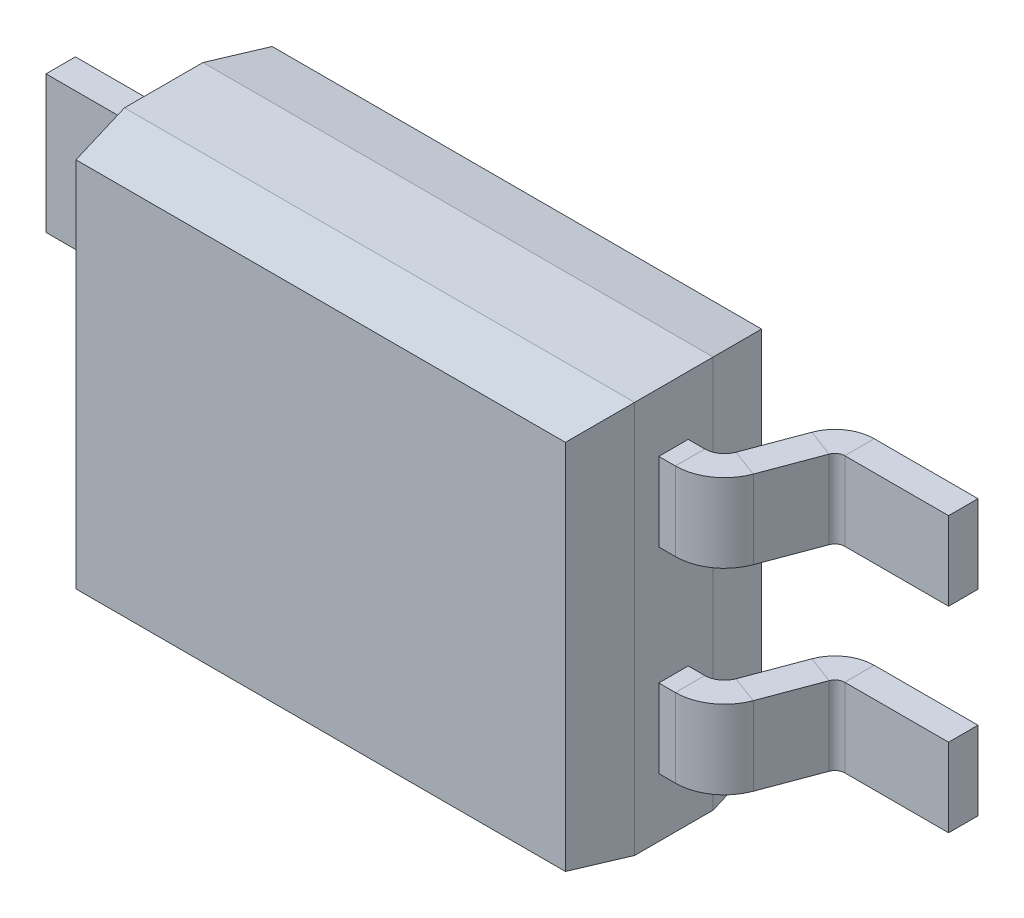
from build123d import *
from OCP.BRepFilletAPI import BRepFilletAPI_MakeChamfer

# Parameters (mm, degrees)
SKETCH1_W           = 2.6
SKETCH1_H           = 2
BOSS_EXTRUDE1_DEPTH = 1
SKETCH2_W           = 0.15
SKETCH2_H           = 0.7
SKETCH4_W           = 0.15
SKETCH4_H           = 0.4
LPATTERN1_COUNT     = 2
LPATTERN1_PITCH     = 1
CHAMFER1_SIZE       = 0.3
CHAMFER1_SIZE2      = 0.052898094
CHAMFER3_SIZE       = 0.3
CHAMFER3_SIZE2      = 0.052898094


with BuildPart() as part:
    # Sketch1 → Boss-Extrude1 (new body)
    with BuildSketch(Plane.XY):
        Rectangle(SKETCH1_W, SKETCH1_H)
    extrude(amount=BOSS_EXTRUDE1_DEPTH)

    # Sweep1: sweep along a path in Sketch3
    with BuildLine(Plane(origin=(0, 0, 0), x_dir=(1, 0, 0), z_dir=(0, 1, 0))) as sweep1_path:
        Line((-2.3, -0.025), (-1.79443196, -0.025))
        ThreePointArc((-1.79443196, -0.025), (-1.705398673, -0.054281012), (-1.651125184, -0.130692347))
        Line((-1.651125184, -0.130692347), (-1.576770506, -0.371181935))
        ThreePointArc((-1.576770506, -0.371181935), (-1.522497017, -0.44759327), (-1.433463731, -0.476874282))
        Line((-1.433463731, -0.476874282), (-0.426220015, -0.476874282))
    # Sketch2 → Sweep1 (sweep)
    with BuildSketch(Plane.ZY.offset(2.3)):
        with Locations((0.025, 0)):
            Rectangle(SKETCH2_W, SKETCH2_H)
    sweep(path=sweep1_path.line)

    # Sweep3: sweep along a path in Sketch5
    with BuildLine(Plane(origin=(0, -0.5, 0), x_dir=(1, 0, 0), z_dir=(0, 1, 0))) as sweep3_path:
        Line((2.3, 0), (1.770889152, 0))
        ThreePointArc((1.770889152, 0), (1.685353834, -0.026777805), (1.630357823, -0.097550541))
        Line((1.630357823, -0.097550541), (1.525193715, -0.379323741))
        ThreePointArc((1.525193715, -0.379323741), (1.470197705, -0.450096477), (1.384662387, -0.476874282))
        Line((1.384662387, -0.476874282), (0.631515544, -0.476874282))
    # Sketch4 → Sweep3 (sweep)
    with BuildSketch(Plane(origin=(2.3, 0, 0), x_dir=(0, 0, -1), z_dir=(1, 0, 0))):
        with Locations((-0.025, -0.5)):
            Rectangle(SKETCH4_W, SKETCH4_H)
    sweep3 = sweep(path=sweep3_path.line)

    # LPattern1: Sweep3 ×2
    with Locations(*[(0, i * LPATTERN1_PITCH, 0) for i in range(1, LPATTERN1_COUNT)]):
        add(sweep3)

    # Chamfer1: one chamfer whose edges measure the first distance from different faces: ONE call of the kernel's chamfer builder (chamfer() names one face for all edges)
    chamfer1_edges_1 = [part.edges().sort_by_distance(p)[0] for p in [
        (0, 1, 1),
    ]]
    chamfer1_side_1 = [part.faces().sort_by_distance(p)[0] for p in [
        (0, 1, 0.5),
    ]]
    chamfer1_edges_2 = [part.edges().sort_by_distance(p)[0] for p in [
        (-1.3, 0, 1),
    ]]
    chamfer1_side_2 = [part.faces().sort_by_distance(p)[0] for p in [
        (-1.3, 0.97763932, 0.5),
    ]]
    chamfer1_edges_3 = [part.edges().sort_by_distance(p)[0] for p in [
        (0, -1, 1),
    ]]
    chamfer1_side_3 = [part.faces().sort_by_distance(p)[0] for p in [
        (0, -1, 0.5),
    ]]
    chamfer1_edges_4 = [part.edges().sort_by_distance(p)[0] for p in [
        (1.3, 0, 1),
    ]]
    chamfer1_side_4 = [part.faces().sort_by_distance(p)[0] for p in [
        (1.3, 0, 0.499880365),
    ]]
    chamfer1 = BRepFilletAPI_MakeChamfer(part.part.solid().wrapped)
    for e in chamfer1_edges_1:
        chamfer1.Add(CHAMFER1_SIZE, CHAMFER1_SIZE2, e.wrapped, chamfer1_side_1[0].wrapped)  # the first distance lies on this face
    for e in chamfer1_edges_2:
        chamfer1.Add(CHAMFER1_SIZE, CHAMFER1_SIZE2, e.wrapped, chamfer1_side_2[0].wrapped)  # the first distance lies on this face
    for e in chamfer1_edges_3:
        chamfer1.Add(CHAMFER1_SIZE, CHAMFER1_SIZE2, e.wrapped, chamfer1_side_3[0].wrapped)  # the first distance lies on this face
    for e in chamfer1_edges_4:
        chamfer1.Add(CHAMFER1_SIZE, CHAMFER1_SIZE2, e.wrapped, chamfer1_side_4[0].wrapped)  # the first distance lies on this face
    add(Compound.cast(chamfer1.Shape()), mode=Mode.REPLACE)

    # Chamfer3: one chamfer whose edges measure the first distance from different faces: ONE call of the kernel's chamfer builder (chamfer() names one face for all edges)
    chamfer3_edges_1 = [part.edges().sort_by_distance(p)[0] for p in [
        (-1.3, 0, 0),
    ]]
    chamfer3_side_1 = [part.faces().sort_by_distance(p)[0] for p in [
        (-1.3, 0, 0.339712896),
    ]]
    chamfer3_edges_2 = [part.edges().sort_by_distance(p)[0] for p in [
        (0, 1, 0),
    ]]
    chamfer3_side_2 = [part.faces().sort_by_distance(p)[0] for p in [
        (0, 1, 0.35),
    ]]
    chamfer3_edges_3 = [part.edges().sort_by_distance(p)[0] for p in [
        (1.3, 0, 0),
    ]]
    chamfer3_side_3 = [part.faces().sort_by_distance(p)[0] for p in [
        (1.3, 0, 0.335761786),
    ]]
    chamfer3_edges_4 = [part.edges().sort_by_distance(p)[0] for p in [
        (0, -1, 0),
    ]]
    chamfer3_side_4 = [part.faces().sort_by_distance(p)[0] for p in [
        (0, -1, 0.35),
    ]]
    chamfer3 = BRepFilletAPI_MakeChamfer(part.part.solid().wrapped)
    for e in chamfer3_edges_1:
        chamfer3.Add(CHAMFER3_SIZE, CHAMFER3_SIZE2, e.wrapped, chamfer3_side_1[0].wrapped)  # the first distance lies on this face
    for e in chamfer3_edges_2:
        chamfer3.Add(CHAMFER3_SIZE, CHAMFER3_SIZE2, e.wrapped, chamfer3_side_2[0].wrapped)  # the first distance lies on this face
    for e in chamfer3_edges_3:
        chamfer3.Add(CHAMFER3_SIZE, CHAMFER3_SIZE2, e.wrapped, chamfer3_side_3[0].wrapped)  # the first distance lies on this face
    for e in chamfer3_edges_4:
        chamfer3.Add(CHAMFER3_SIZE, CHAMFER3_SIZE2, e.wrapped, chamfer3_side_4[0].wrapped)  # the first distance lies on this face
    add(Compound.cast(chamfer3.Shape()), mode=Mode.REPLACE)


solid = part.part
